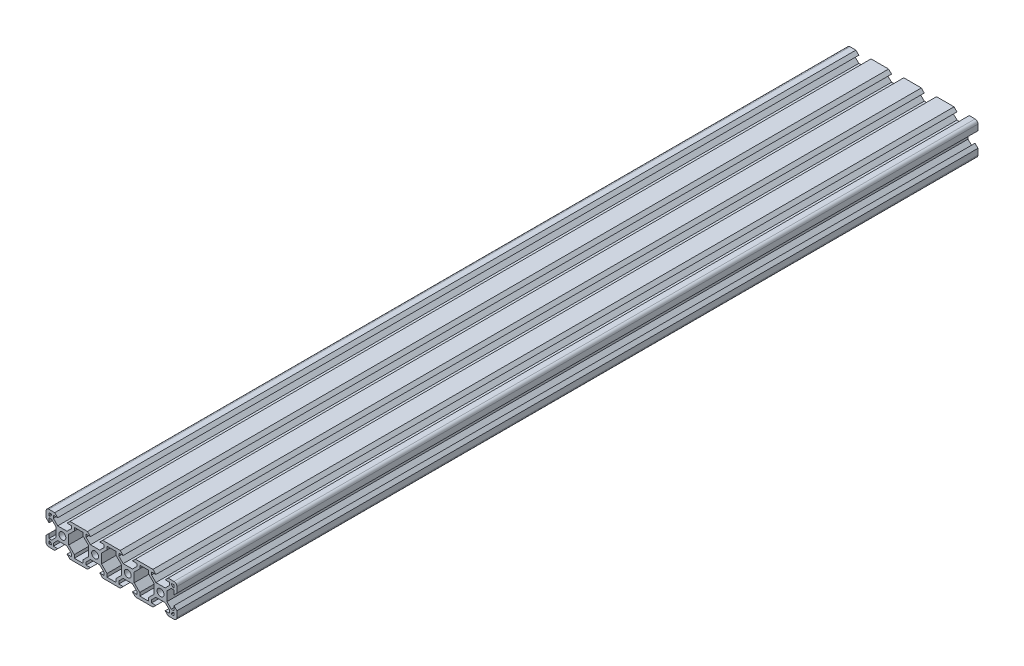
from build123d import *

# Parameters (mm, degrees)
SKETCH1_R      = 2.1
EXTRUDE1_DEPTH = 244.8


with BuildPart() as part:
    # Sketch1 → Extrude1 (new, symmetric)
    with BuildSketch(Plane.XY):
        with BuildLine():
            Line((-38.199999929, 10), (-34.639999675, 10))
            Line((-34.639999675, 10), (-32.839999603, 8.2))
            Line((-32.839999603, 8.2), (-35.499339671, 8.2))
            Line((-35.499339671, 8.2), (-35.499339671, 6.56))
            Line((-35.499339671, 6.56), (-32.839999603, 3.900660038))
            Line((-32.839999603, 3.900660038), (-27.159999603, 3.900660038))
            Line((-27.159999603, 3.900660038), (-24.500659536, 6.56))
            Line((-24.500659536, 6.56), (-24.500659536, 8.2))
            Line((-24.500659536, 8.2), (-27.159999603, 8.2))
            Line((-27.159999603, 8.2), (-25.359999532, 10))
            Line((-25.359999532, 10), (-14.640000468, 10))
            Line((-14.640000468, 10), (-12.840000397, 8.2))
            Line((-12.840000397, 8.2), (-15.499340464, 8.2))
            Line((-15.499340464, 8.2), (-15.499340464, 6.56))
            Line((-15.499340464, 6.56), (-12.840000397, 3.900660038))
            Line((-12.840000397, 3.900660038), (-7.159998809, 3.900660038))
            Line((-7.159998809, 3.900660038), (-4.500658742, 6.56))
            Line((-4.500658742, 6.56), (-4.500658742, 8.2))
            Line((-4.500658742, 8.2), (-7.159998809, 8.2))
            Line((-7.159998809, 8.2), (-5.359998738, 10))
            Line((-5.359998738, 10), (5.359998738, 10))
            Line((5.359998738, 10), (7.159998809, 8.2))
            Line((7.159998809, 8.2), (4.500658742, 8.2))
            Line((4.500658742, 8.2), (4.500658742, 6.56))
            Line((4.500658742, 6.56), (7.159998809, 3.900660038))
            Line((7.159998809, 3.900660038), (12.840000397, 3.900660038))
            Line((12.840000397, 3.900660038), (15.499340464, 6.56))
            Line((15.499340464, 6.56), (15.499340464, 8.2))
            Line((15.499340464, 8.2), (12.840000397, 8.2))
            Line((12.840000397, 8.2), (14.640000468, 10))
            Line((14.640000468, 10), (25.359999532, 10))
            Line((25.359999532, 10), (27.159999603, 8.2))
            Line((27.159999603, 8.2), (24.500659536, 8.2))
            Line((24.500659536, 8.2), (24.500659536, 6.56))
            Line((24.500659536, 6.56), (27.159999603, 3.900660038))
            Line((27.159999603, 3.900660038), (32.839999603, 3.900660038))
            Line((32.839999603, 3.900660038), (35.499339671, 6.56))
            Line((35.499339671, 6.56), (35.499339671, 8.2))
            Line((35.499339671, 8.2), (32.839999603, 8.2))
            Line((32.839999603, 8.2), (34.639999675, 10))
            Line((34.639999675, 10), (38.199999929, 10))
            ThreePointArc((38.199999929, 10), (39.47279216, 9.472792181), (39.999999929, 8.199999929))
            Line((39.999999929, 8.199999929), (39.999999787, 4.639999675))
            Line((39.999999787, 4.639999675), (38.199999716, 2.839999675))
            Line((38.199999716, 2.839999675), (38.199999821, 5.499339742))
            Line((38.199999821, 5.499339742), (36.559999821, 5.499339807))
            Line((36.559999821, 5.499339807), (33.900659754, 2.839999845))
            Line((33.900659754, 2.839999845), (33.900659641, 0))
            Line((33.900659641, 0), (33.900659754, -2.839999845))
            Line((33.900659754, -2.839999845), (36.559999821, -5.499339807))
            Line((36.559999821, -5.499339807), (38.199999821, -5.499339742))
            Line((38.199999821, -5.499339742), (38.199999716, -2.839999675))
            Line((38.199999716, -2.839999675), (39.999999787, -4.639999675))
            Line((39.999999787, -4.639999675), (39.999999929, -8.199999929))
            ThreePointArc((39.999999929, -8.199999929), (39.47279216, -9.472792181), (38.199999929, -10))
            Line((38.199999929, -10), (34.639999675, -10))
            Line((34.639999675, -10), (32.839999603, -8.2))
            Line((32.839999603, -8.2), (35.499339671, -8.2))
            Line((35.499339671, -8.2), (35.499339671, -6.56))
            Line((35.499339671, -6.56), (32.839999603, -3.900660038))
            Line((32.839999603, -3.900660038), (27.159999603, -3.900660038))
            Line((27.159999603, -3.900660038), (24.500659536, -6.56))
            Line((24.500659536, -6.56), (24.500659536, -8.2))
            Line((24.500659536, -8.2), (27.159999603, -8.2))
            Line((27.159999603, -8.2), (25.359999532, -10))
            Line((25.359999532, -10), (14.640000468, -10))
            Line((14.640000468, -10), (12.840000397, -8.2))
            Line((12.840000397, -8.2), (15.499340464, -8.2))
            Line((15.499340464, -8.2), (15.499340464, -6.56))
            Line((15.499340464, -6.56), (12.840000397, -3.900660038))
            Line((12.840000397, -3.900660038), (7.159998809, -3.900660038))
            Line((7.159998809, -3.900660038), (4.500658742, -6.56))
            Line((4.500658742, -6.56), (4.500658742, -8.2))
            Line((4.500658742, -8.2), (7.159998809, -8.2))
            Line((7.159998809, -8.2), (5.359998738, -10))
            Line((5.359998738, -10), (-5.359998738, -10))
            Line((-5.359998738, -10), (-7.159998809, -8.2))
            Line((-7.159998809, -8.2), (-4.500658742, -8.2))
            Line((-4.500658742, -8.2), (-4.500658742, -6.56))
            Line((-4.500658742, -6.56), (-7.159998809, -3.900660038))
            Line((-7.159998809, -3.900660038), (-12.840000397, -3.900660038))
            Line((-12.840000397, -3.900660038), (-15.499340464, -6.56))
            Line((-15.499340464, -6.56), (-15.499340464, -8.2))
            Line((-15.499340464, -8.2), (-12.840000397, -8.2))
            Line((-12.840000397, -8.2), (-14.640000468, -10))
            Line((-14.640000468, -10), (-25.359999532, -10))
            Line((-25.359999532, -10), (-27.159999603, -8.2))
            Line((-27.159999603, -8.2), (-24.500659536, -8.2))
            Line((-24.500659536, -8.2), (-24.500659536, -6.56))
            Line((-24.500659536, -6.56), (-27.159999603, -3.900660038))
            Line((-27.159999603, -3.900660038), (-32.839999603, -3.900660038))
            Line((-32.839999603, -3.900660038), (-35.499339671, -6.56))
            Line((-35.499339671, -6.56), (-35.499339671, -8.2))
            Line((-35.499339671, -8.2), (-32.839999603, -8.2))
            Line((-32.839999603, -8.2), (-34.639999675, -10))
            Line((-34.639999675, -10), (-38.199999929, -10))
            ThreePointArc((-38.199999929, -10), (-39.47279216, -9.472792181), (-39.999999929, -8.199999929))
            Line((-39.999999929, -8.199999929), (-39.999999787, -4.639999675))
            Line((-39.999999787, -4.639999675), (-38.199999716, -2.839999675))
            Line((-38.199999716, -2.839999675), (-38.199999821, -5.499339742))
            Line((-38.199999821, -5.499339742), (-36.559999821, -5.499339807))
            Line((-36.559999821, -5.499339807), (-33.900659754, -2.839999845))
            Line((-33.900659754, -2.839999845), (-33.900659641, 0))
            Line((-33.900659641, 0), (-33.900659754, 2.839999845))
            Line((-33.900659754, 2.839999845), (-36.559999821, 5.499339807))
            Line((-36.559999821, 5.499339807), (-38.199999821, 5.499339742))
            Line((-38.199999821, 5.499339742), (-38.199999716, 2.839999675))
            Line((-38.199999716, 2.839999675), (-39.999999787, 4.639999675))
            Line((-39.999999787, 4.639999675), (-39.999999929, 8.199999929))
            ThreePointArc((-39.999999929, 8.199999929), (-39.47279216, 9.472792181), (-38.199999929, 10))
        make_face()
        with Locations((-29.999999603, 0)):
            Circle(SKETCH1_R, mode=Mode.SUBTRACT)
        with Locations((-9.999999603, 0)):
            Circle(SKETCH1_R, mode=Mode.SUBTRACT)
        with Locations(Location((29.999999603, 0, 0), (0, 0, 180))):
            Circle(SKETCH1_R, mode=Mode.SUBTRACT)
        with Locations(Location((9.999999603, 0, 0), (0, 0, 180))):
            Circle(SKETCH1_R, mode=Mode.SUBTRACT)
        Polygon((-38.199999929, 8.2), (-38.199999864, 6.569339742), (-37.629999799, 6.569339742), (-36.569339648, 7.629999935), (-36.569339648, 8.2), align=None, mode=Mode.SUBTRACT)
        Polygon((-17.3, 6.239339079), (-17.3, 8.2), (-22.7, 8.2), (-22.7, 6.239339079), (-26.099339368, 2.839999845), (-26.099339368, -2.839999845), (-22.7, -6.239339079), (-22.7, -8.2), (-17.3, -8.2), (-17.3, -6.239339079), (-13.900660632, -2.839999845), (-13.900660632, 2.839999845), align=None, mode=Mode.SUBTRACT)
        Polygon((-6.099339678, -2.840000949), (-6.099339678, 2.840000949), (-2.700001413, 6.239339079), (-2.700001413, 8.2), (2.700001413, 8.2), (2.700001413, 6.239339079), (6.099339678, 2.840000949), (6.099339678, -2.840000949), (2.700001413, -6.239339079), (2.700001413, -8.2), (-2.700001413, -8.2), (-2.700001413, -6.239339079), align=None, mode=Mode.SUBTRACT)
        Polygon((-36.569339648, -7.629999935), (-36.569339648, -8.2), (-38.199999929, -8.2), (-38.199999864, -6.569339742), (-37.629999799, -6.569339742), align=None, mode=Mode.SUBTRACT)
        Polygon((36.569339648, 8.2), (38.199999929, 8.2), (38.199999864, 6.569339742), (37.629999799, 6.569339742), (36.569339648, 7.629999935), align=None, mode=Mode.SUBTRACT)
        Polygon((36.569339648, -8.2), (38.199999929, -8.2), (38.199999864, -6.569339742), (37.629999799, -6.569339742), (36.569339648, -7.629999935), align=None, mode=Mode.SUBTRACT)
        Polygon((13.900660632, -2.839999845), (17.3, -6.239339079), (17.3, -8.2), (22.7, -8.2), (22.7, -6.239339079), (26.099339368, -2.839999845), (26.099339368, 2.839999845), (22.7, 6.239339079), (22.7, 8.2), (17.3, 8.2), (17.3, 6.239339079), (13.900660632, 2.839999845), align=None, mode=Mode.SUBTRACT)
    extrude(amount=EXTRUDE1_DEPTH, both=True)


solid = part.part
